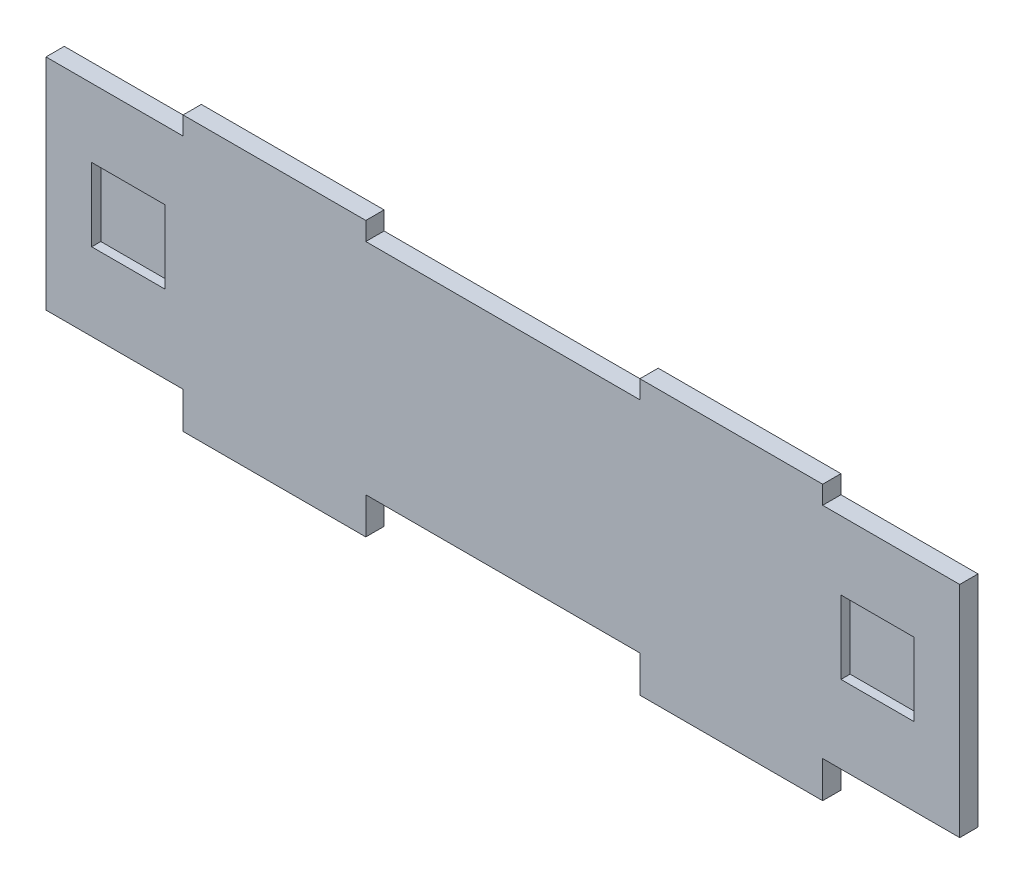
from build123d import *

# Parameters (mm, degrees)
BOSS_EXTRUDE1_DEPTH = 4
SKETCH2_W           = 16
SKETCH2_H           = 16
CUT_EXTRUDE1_DEPTH  = 2


with BuildPart() as part:
    # Sketch1 → Boss-Extrude1 (new body)
    with BuildSketch(Plane.XY):
        Polygon((30, 60), (70, 60), (70, 56), (130, 56), (130, 60), (170, 60), (170, 56), (200, 56), (200, 8), (170, 8), (170, 0), (130, 0), (130, 8), (70, 8), (70, 0), (30, 0), (30, 8), (0, 8), (0, 56), (30, 56), align=None)
    extrude(amount=BOSS_EXTRUDE1_DEPTH)

    # Sketch2 → Cut-Extrude1 (cut)
    with BuildSketch(Plane.XY.offset(4)):
        with Locations((18, 33)):
            Rectangle(SKETCH2_W, SKETCH2_H)
        with Locations((182, 33)):
            Rectangle(SKETCH2_W, SKETCH2_H)
    extrude(amount=-CUT_EXTRUDE1_DEPTH, mode=Mode.SUBTRACT)


solid = part.part
